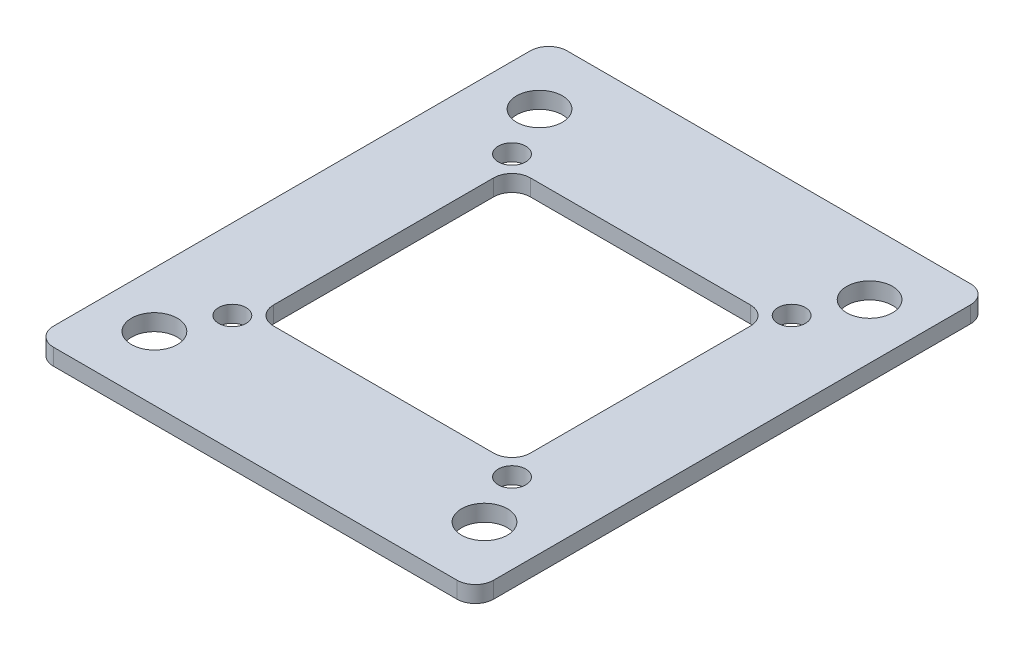
from build123d import *

# Parameters (mm, degrees)
SKETCH_1_W          = 48
SKETCH_1_H          = 56
SKETCH_1_R          = 2.5
EXTRUDE_1_DEPTH     = 1.8
SKETCH_2_R          = 1.5
SKETCH_2_W          = 28
SKETCH_2_H          = 28
CUT_EXTRUDE_1_DEPTH = 37.922080115
FILLET_1_R          = 2


with BuildPart() as part:
    # 草图1 → 凸台-拉伸1 (new body)
    with BuildSketch(Plane(origin=(0, 0, 0), x_dir=(1, 0, 0), z_dir=(0, 1, 0))):
        Rectangle(SKETCH_1_W, SKETCH_1_H)
        with Locations(Location((-18, 21, 0), (0, 0, 270))):
            Circle(SKETCH_1_R, mode=Mode.SUBTRACT)
        with Locations(Location((18, 21, 0), (0, 0, 90))):
            Circle(SKETCH_1_R, mode=Mode.SUBTRACT)
        with Locations(Location((18, -21, 0), (0, 0, 270))):
            Circle(SKETCH_1_R, mode=Mode.SUBTRACT)
        with Locations(Location((-18, -21, 0), (0, 0, 90))):
            Circle(SKETCH_1_R, mode=Mode.SUBTRACT)
    extrude(amount=EXTRUDE_1_DEPTH)

    # 草图2 → 切除-拉伸1 (cut, through all)
    with BuildSketch(Plane(origin=(0, 1.8, 0), x_dir=(1, 0, 0), z_dir=(0, 1, 0))):
        with Locations(Location((15.25, 15.25, 0), (0, 0, 270))):
            Circle(SKETCH_2_R)
        with Locations(Location((-15.25, 15.25, 0), (0, 0, 90))):
            Circle(SKETCH_2_R)
        with Locations(Location((15.25, -15.25, 0), (0, 0, 90))):
            Circle(SKETCH_2_R)
        with Locations(Location((-15.25, -15.25, 0), (0, 0, 270))):
            Circle(SKETCH_2_R)
        Rectangle(SKETCH_2_W, SKETCH_2_H)
    extrude(amount=-CUT_EXTRUDE_1_DEPTH, mode=Mode.SUBTRACT)

    # 圆角1
    fillet_1_edges = [part.edges().sort_by_distance(p)[0] for p in [
        (14, 0.9, -14),
        (14, 0.9, 14),
        (-14, 0.9, 14),
        (-14, 0.9, -14),
        (24, 0.9, 28),
        (-24, 0.9, 28),
        (-24, 0.9, -28),
        (24, 0.9, -28),
    ]]
    fillet(fillet_1_edges, radius=FILLET_1_R)


solid = part.part
